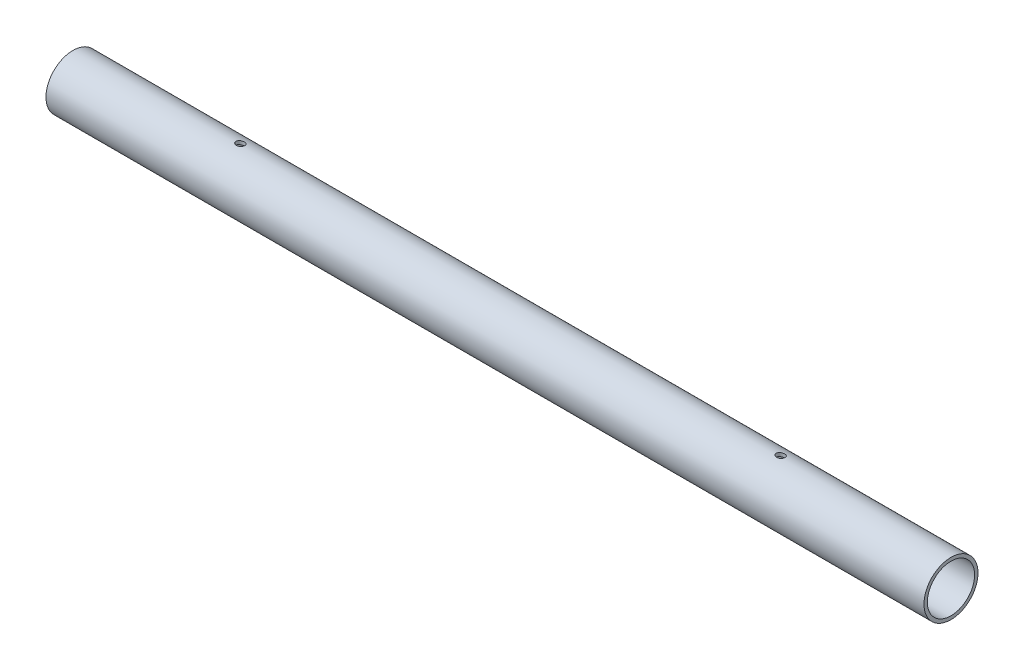
from build123d import *

# Parameters (mm, degrees)
SKETCH2_R           = 20
SKETCH2_R_2         = 17.5
BOSS_EXTRUDE1_DEPTH = 650
SKETCH3_R           = 3
CUT_EXTRUDE1_DEPTH  = 30


with BuildPart() as part:
    # Sketch2 → Boss-Extrude1 (new body)
    with BuildSketch(Plane(origin=(0, 0, 0), x_dir=(0, 0, -1), z_dir=(1, 0, 0))):
        Circle(SKETCH2_R)
        Circle(SKETCH2_R_2, mode=Mode.SUBTRACT)
    extrude(amount=BOSS_EXTRUDE1_DEPTH)

    # Sketch3 → Cut-Extrude1 (cut, symmetric)
    with BuildSketch(Plane(origin=(0, 0, 0), x_dir=(1, 0, 0), z_dir=(0, 1, 0))):
        with Locations(Location((121.46797255, 2.5, 0), (0, 0, 270))):
            Circle(SKETCH3_R)
        with Locations(Location((521.46797255, 2.5, 0), (0, 0, 270))):
            Circle(SKETCH3_R)
    extrude(amount=CUT_EXTRUDE1_DEPTH, both=True, mode=Mode.SUBTRACT)


solid = part.part
